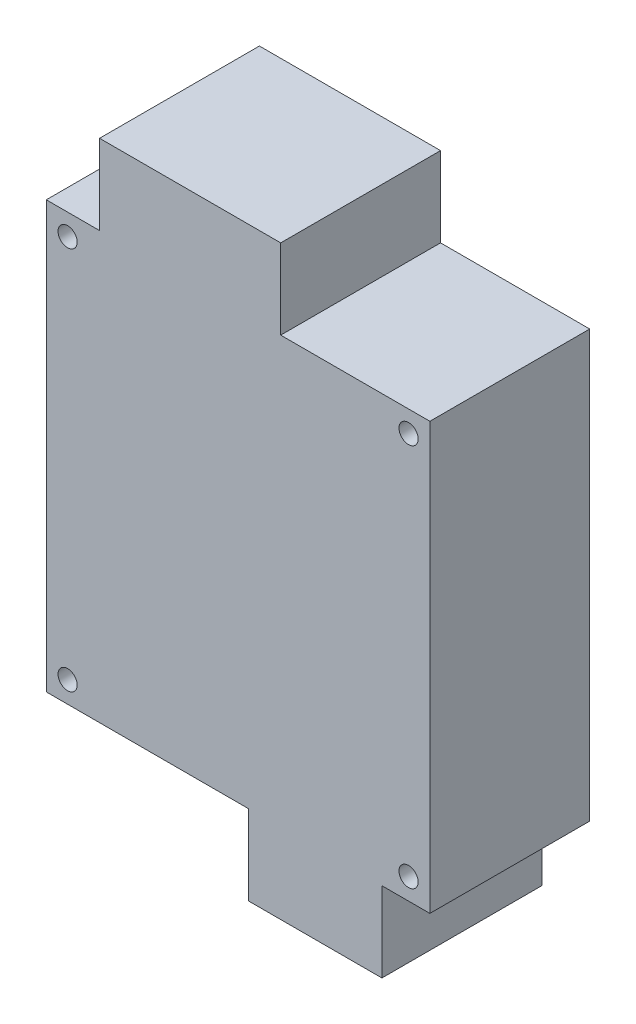
from build123d import *

# Parameters (mm, degrees)
ESQUISSE1_W             = 72
ESQUISSE1_H             = 110
BOSS_EXTRU_1_DEPTH      = 30
D_GAGEMENT_M31_D        = 3.6
ESQUISSE5_W             = 10
ESQUISSE5_H             = 15
ESQUISSE5_W_2           = 38
ENL_V_MAT_EXTRU_1_DEPTH = 30
ESQUISSE6_W             = 28
ESQUISSE6_H             = 15
ESQUISSE6_W_2           = 9
ENL_V_MAT_EXTRU_2_DEPTH = 30


with BuildPart() as part:
    # Esquisse1 → Boss.-Extru.1 (new body)
    with BuildSketch(Plane.XY):
        with Locations((36, 55)):
            Rectangle(ESQUISSE1_W, ESQUISSE1_H)
    extrude(amount=BOSS_EXTRU_1_DEPTH)

    # Dégagement M31 (through all)
    with Locations(Plane.XY.offset(30)):
        with Locations((4, 91), (68, 91), (4, 19), (68, 19)):
            Hole(D_GAGEMENT_M31_D / 2)

    # Esquisse5 → Enlèv. mat.-Extru.1 (cut)
    with BuildSketch(Plane(origin=(0, 0, 0), x_dir=(-1, 0, 0), z_dir=(0, 0, -1))):
        with Locations((-5, 102.5)):
            Rectangle(ESQUISSE5_W, ESQUISSE5_H)
        with Locations((-19, 7.5)):
            Rectangle(ESQUISSE5_W_2, ESQUISSE5_H)
    extrude(amount=-ENL_V_MAT_EXTRU_1_DEPTH, mode=Mode.SUBTRACT)

    # Esquisse6 → Enlèv. mat.-Extru.2 (cut)
    with BuildSketch(Plane(origin=(0, 0, 0), x_dir=(-1, 0, 0), z_dir=(0, 0, -1))):
        with Locations((-58, 102.5)):
            Rectangle(ESQUISSE6_W, ESQUISSE6_H)
        with Locations((-67.5, 7.5)):
            Rectangle(ESQUISSE6_W_2, ESQUISSE6_H)
    extrude(amount=-ENL_V_MAT_EXTRU_2_DEPTH, mode=Mode.SUBTRACT)


solid = part.part
